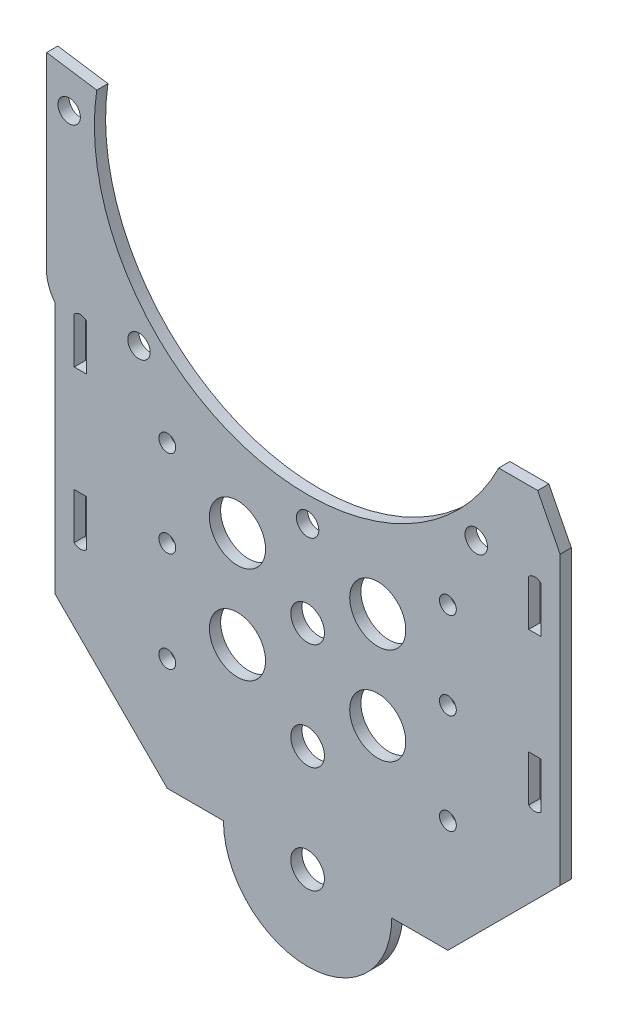
from build123d import *

# Parameters (mm, degrees)
SKETCH_3_R      = 3
SKETCH_3_R_2    = 2
SKETCH_3_R_3    = 1.5
SKETCH_3_R_4    = 5
EXTRUDE_1_DEPTH = 2


with BuildPart() as part:
    # 草图3 → 凸台-拉伸1 (new body)
    with BuildSketch(Plane.XY):
        with BuildLine():
            Line((-45, -3.990216685), (-45, -19.82))
            Line((-45, -19.82), (-25, -39.82))
            Line((-25, -39.82), (-15, -39.82))
            ThreePointArc((-15, -39.82), (0, -54.82), (15, -39.82))
            Line((15, -39.82), (25, -39.82))
            Line((25, -39.82), (45, -19.82))
            Line((45, -19.82), (45, -3.990216685))
            Line((45, -3.990216685), (45, 31.317051182))
            Line((45, 31.317051182), (41, 39.152540881))
            Line((41, 39.152540881), (34.06116735, 39.152540881))
            ThreePointArc((34.06116735, 39.152540881), (-11.38853896, 19.746708007), (-37.576612526, 61.656694359))
            Line((-37.576612526, 61.656694359), (-46.5, 63))
            Line((-46.5, 63), (-46.5, 28.773494756))
            add(Edge.make_bspline(
                [(-45, 25.109783315), (-46.274240542, 26.725120767), (-46.5, 28.773494756)],
                knots=[0, 0, 0, 1, 1, 1], degree=2))
            Line((-45, 25.109783315), (-45, -3.990216685))
        make_face()
        with Locations((0, -1.82)):
            Circle(SKETCH_3_R, mode=Mode.SUBTRACT)
        with Locations((0, 13.5)):
            Circle(SKETCH_3_R_2, mode=Mode.SUBTRACT)
        with Locations((-30.0520382, 25.9479618)):
            Circle(SKETCH_3_R_2, mode=Mode.SUBTRACT)
        with Locations((-42.5, 56)):
            Circle(SKETCH_3_R_2, mode=Mode.SUBTRACT)
        with Locations((30.0520382, 25.9479618)):
            Circle(SKETCH_3_R_2, mode=Mode.SUBTRACT)
        with Locations((0, -20.82)):
            Circle(SKETCH_3_R, mode=Mode.SUBTRACT)
        with Locations((0, -39.82)):
            Circle(SKETCH_3_R, mode=Mode.SUBTRACT)
        with Locations((-25, -1.990216685)):
            Circle(SKETCH_3_R_3, mode=Mode.SUBTRACT)
        with Locations((-25, -19.82)):
            Circle(SKETCH_3_R_3, mode=Mode.SUBTRACT)
        with Locations((-25, 13.509783315)):
            Circle(SKETCH_3_R_3, mode=Mode.SUBTRACT)
        with Locations(Location((25, 13.509783315, 0), (0, 0, 180))):
            Circle(SKETCH_3_R_3, mode=Mode.SUBTRACT)
        with Locations(Location((25, -19.82, 0), (0, 0, 180))):
            Circle(SKETCH_3_R_3, mode=Mode.SUBTRACT)
        with Locations(Location((25, -1.990216685, 0), (0, 0, 180))):
            Circle(SKETCH_3_R_3, mode=Mode.SUBTRACT)
        with Locations((-12.5, -11.405108343)):
            Circle(SKETCH_3_R_4, mode=Mode.SUBTRACT)
        with Locations((-12.5, 5.844891657)):
            Circle(SKETCH_3_R_4, mode=Mode.SUBTRACT)
        with Locations(Location((12.5, 5.844891657, 0), (0, 0, 180))):
            Circle(SKETCH_3_R_4, mode=Mode.SUBTRACT)
        with Locations(Location((12.5, -11.405108343, 0), (0, 0, 180))):
            Circle(SKETCH_3_R_4, mode=Mode.SUBTRACT)
        with BuildLine():
            Line((-41.6, -1.990216685), (-39.4, -1.990216685))
            Line((-39.4, -1.990216685), (-39.4, -10.190216685))
            ThreePointArc((-39.4, -10.190216685), (-40.5, -10.645851604), (-41.6, -10.190216685))
            Line((-41.6, -10.190216685), (-41.6, -1.990216685))
        make_face(mode=Mode.SUBTRACT)
        with BuildLine():
            Line((41.6, -10.190216685), (41.6, -1.990216685))
            Line((41.6, -1.990216685), (39.4, -1.990216685))
            Line((39.4, -1.990216685), (39.4, -10.190216685))
            ThreePointArc((39.4, -10.190216685), (40.5, -10.645851604), (41.6, -10.190216685))
        make_face(mode=Mode.SUBTRACT)
        with BuildLine():
            Line((39.4, 25.109783315), (39.4, 16.909783315))
            Line((39.4, 16.909783315), (41.6, 16.909783315))
            Line((41.6, 16.909783315), (41.6, 25.109783315))
            ThreePointArc((41.6, 25.109783315), (40.5, 25.565418233), (39.4, 25.109783315))
        make_face(mode=Mode.SUBTRACT)
        with BuildLine():
            Line((-41.6, 25.109783315), (-41.6, 16.909783315))
            Line((-41.6, 16.909783315), (-39.4, 16.909783315))
            Line((-39.4, 16.909783315), (-39.4, 25.109783315))
            ThreePointArc((-39.4, 25.109783315), (-40.5, 25.565418233), (-41.6, 25.109783315))
        make_face(mode=Mode.SUBTRACT)
    extrude(amount=EXTRUDE_1_DEPTH)


solid = part.part
